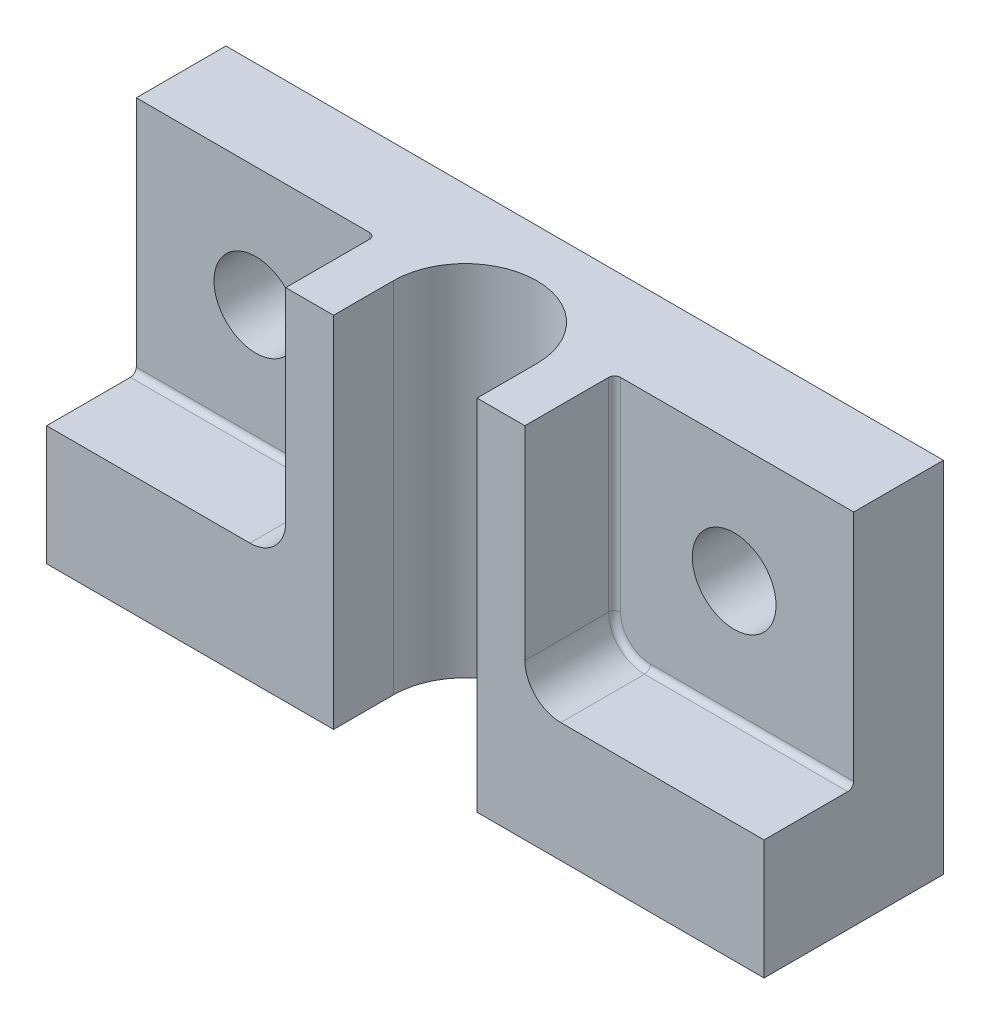
from build123d import *

# Parameters (mm, degrees)
SKETCH1_W      = 60
SKETCH1_H      = 30
SKETCH1_R      = 3.5
EXTRUDE1_DEPTH = 15
EXTRUDE2_DEPTH = 7.5
EXTRUDE3_DEPTH = 46
FILLET1_R      = 0.5


with BuildPart() as part:
    # Sketch1 → Extrude1 (new body)
    with BuildSketch(Plane.XY):
        with Locations((0, -15)):
            Rectangle(SKETCH1_W, SKETCH1_H)
        with Locations((20, -10)):
            Circle(SKETCH1_R, mode=Mode.SUBTRACT)
        with Locations((-20, -10)):
            Circle(SKETCH1_R, mode=Mode.SUBTRACT)
    extrude(amount=-EXTRUDE1_DEPTH)

    # Sketch2 → Extrude2 (cut)
    with BuildSketch(Plane.XY):
        with BuildLine():
            Line((13, -20), (30, -20))
            Line((30, -20), (30, 0))
            Line((30, 0), (10, 0))
            Line((10, 0), (10, -17))
            ThreePointArc((10, -17), (10.878679656, -19.121320344), (13, -20))
        make_face()
        with BuildLine():
            Line((-30, -20), (-30, 0))
            Line((-30, 0), (-10, 0))
            Line((-10, 0), (-10, -17))
            ThreePointArc((-10, -17), (-10.878679656, -19.121320344), (-13, -20))
            Line((-13, -20), (-30, -20))
        make_face()
    extrude(amount=-EXTRUDE2_DEPTH, mode=Mode.SUBTRACT)

    # Sketch3 → Extrude3 (cut, through all)
    with BuildSketch(Plane(origin=(0, 0, 0), x_dir=(1, 0, 0), z_dir=(0, 1, 0))):
        with BuildLine():
            Line((6, 0), (6, 5))
            ThreePointArc((6, 5), (0, 11), (-6, 5))
            Line((-6, 5), (-6, 0))
            Line((-6, 0), (6, 0))
        make_face()
    extrude(amount=-EXTRUDE3_DEPTH, mode=Mode.SUBTRACT)

    # Fillet1
    fillet1_edges = [part.edges().sort_by_distance(p)[0] for p in [
        (21.5, -20, -7.5),
        (10.878679656, -19.121320344, -7.5),
        (10, -8.5, -7.5),
        (-10.878679656, -19.121320344, -7.5),
        (-21.5, -20, -7.5),
        (-10, -8.5, -7.5),
    ]]
    fillet(fillet1_edges, radius=FILLET1_R)


solid = part.part
